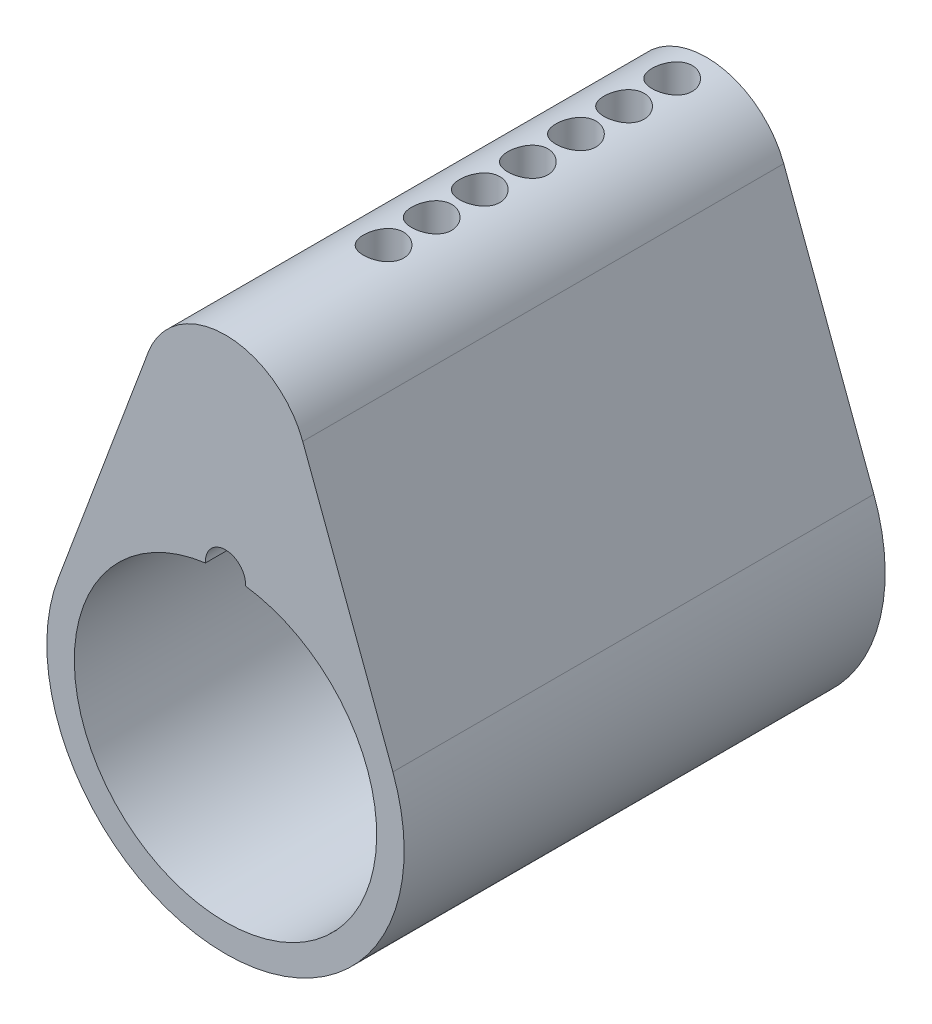
from build123d import *

# Parameters (mm, degrees)
BOSS_EXTRUDE2_DEPTH     = 35
SKETCH2_R               = 11
CUT_EXTRUDE1_DEPTH      = 35
SKETCH3_R               = 1.4605
CUT_EXTRUDE2_DEPTH      = 4.064
CUT_EXTRUDE3_REACH      = 55.991
CUT_EXTRUDE3_END_RADIUS = 11
SKETCH4_R               = 1.4605
LPATTERN1_COUNT         = 7
LPATTERN1_PITCH         = 3.5


with BuildPart() as part:
    # Sketch1 → Boss-Extrude2 (new body)
    with BuildSketch(Plane.XY):
        with BuildLine():
            Line((-12.177746097, -15.45), (-5.620498199, 2.1))
            ThreePointArc((-5.620498199, 2.1), (0, 6), (5.620498199, 2.1))
            Line((5.620498199, 2.1), (12.177746097, -15.45))
            ThreePointArc((12.177746097, -15.45), (0, -33), (-12.177746097, -15.45))
        make_face()
    extrude(amount=-BOSS_EXTRUDE2_DEPTH)

    # Sketch2 → Cut-Extrude1 (cut)
    with BuildSketch(Plane.XY):
        with Locations((0, -20)):
            Circle(SKETCH2_R)
    extrude(amount=-CUT_EXTRUDE1_DEPTH, mode=Mode.SUBTRACT)

    # Sketch3 → Cut-Extrude2 (cut)
    with BuildSketch(Plane.XY):
        with Locations((0, -9)):
            Circle(SKETCH3_R)
    extrude(amount=-CUT_EXTRUDE2_DEPTH, mode=Mode.SUBTRACT)

    # Cut-Extrude3: up to this cylinder (the profile starts outside it)
    cut_extrude3_end = Plane(origin=(0, -20, -32.5), z_dir=(0, 0, 1)) * Cylinder(CUT_EXTRUDE3_END_RADIUS, 134.982, mode=Mode.PRIVATE)
    # Sketch4 → Cut-Extrude3 (cut, up to the surface)
    with BuildSketch(Plane(origin=(0, 6, 0), x_dir=(1, 0, 0), z_dir=(0, 1, 0)), mode=Mode.PRIVATE) as cut_extrude3_sk1:
        with Locations(Location((0, 32.5, 0), (0, 0, 270))):
            Circle(SKETCH4_R)
    cut_extrude3_tool1 = extrude(cut_extrude3_sk1.sketch, amount=-CUT_EXTRUDE3_REACH, mode=Mode.PRIVATE) - cut_extrude3_end
    cut_extrude3 = cut_extrude3_tool1.solids().sort_by_distance((0, 6, -32.5))[0]
    add(cut_extrude3, mode=Mode.SUBTRACT)

    # LPattern1: Cut-Extrude3 ×7
    with Locations(*[(0, 0, i * LPATTERN1_PITCH) for i in range(1, LPATTERN1_COUNT)]):
        add(cut_extrude3, mode=Mode.SUBTRACT)


solid = part.part
